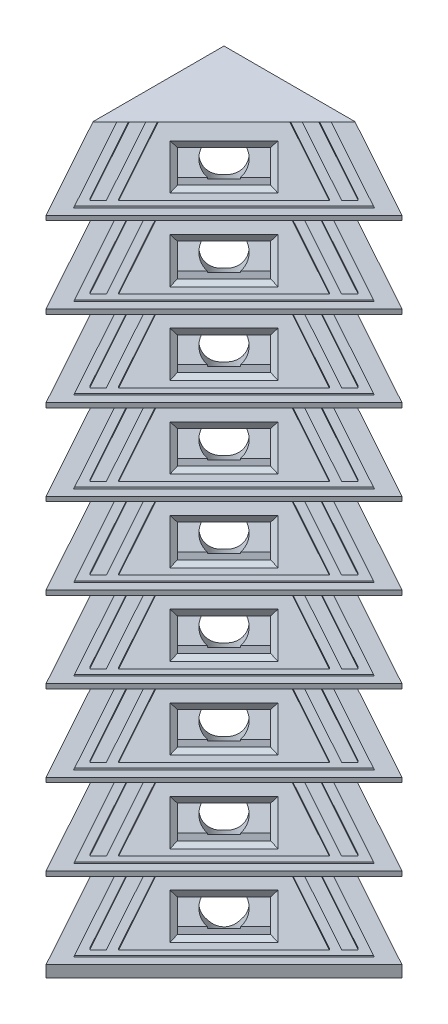
from build123d import *

# Parameters (mm, degrees)
BOSS_EXTRUDE1_DEPTH        = 143
SKETCH6_W                  = 48.08326112
SKETCH6_H                  = 12.658146123
CUT_EXTRUDE2_DEPTH         = 9
CUT_EXTRUDE3_START         = -12.5
SKETCH6_6_W                = 12.6
SKETCH6_6_H                = 5.1
CUT_EXTRUDE3_DEPTH         = 146.771835388
CUT_EXTRUDE4_DEPTH         = 2.5
CUT_EXTRUDE6_START         = -10
SKETCH6_10_R               = 3.4
CUT_EXTRUDE6_DEPTH         = 20
CHAMFER2_SIZE              = 1
CHAMFER1_SIZE              = 10
CHAMFER1_SIZE2             = 5.773502692
LPATTERN4_COUNT            = 9
LPATTERN4_PITCH            = 15.5
LPATTERN4_COPY_1_DEPTH     = 2.5
LPATTERN4_COPY_2_DEPTH     = 2.5
LPATTERN4_COPY_3_DEPTH     = 2.5
LPATTERN4_COPY_4_DEPTH     = 2.5
LPATTERN4_COPY_5_DEPTH     = 2.5
LPATTERN4_COPY_6_DEPTH     = 2.5
LPATTERN4_COPY_7_DEPTH     = 2.5
LPATTERN4_COPY_8_DEPTH     = 2.5
CHAMFER2_OF_LPATTERN4_SIZE = 1


with BuildPart() as part:
    # Sketch1 → Boss-Extrude1 (new body)
    with BuildSketch(Plane(origin=(0, 0, 0), x_dir=(1, 0, 0), z_dir=(0, 1, 0))):
        Polygon((0, 0), (0, -34), (34, 0), align=None)
    extrude(amount=BOSS_EXTRUDE1_DEPTH)

    # Sketch6 → Cut-Extrude2 (cut)
    with BuildSketch(Plane(origin=(15.196708808, 12.408060783, 15.196708808), x_dir=(0.7071067811865475, 0, -0.7071067811865476), z_dir=(0.6123724356957942, 0.5000000000000011, 0.6123724356957941))):
        with Locations((0, 1.228595341)):
            Rectangle(SKETCH6_W, SKETCH6_H)
    cut_extrude2 = extrude(amount=CUT_EXTRUDE2_DEPTH, mode=Mode.SUBTRACT)

    # Sketch6<6> → Cut-Extrude3 (cut)
    with BuildSketch(Plane(origin=(15.196708808, 12.408060783, 15.196708808), x_dir=(0.7071067811865475, 0, -0.7071067811865476), z_dir=(0.6123724356957942, 0.5000000000000011, 0.6123724356957941)).offset(CUT_EXTRUDE3_START)):
        with Locations((0, 1.449522279)):
            Rectangle(SKETCH6_6_W, SKETCH6_6_H)
    cut_extrude3 = extrude(amount=CUT_EXTRUDE3_DEPTH, mode=Mode.SUBTRACT)

    # Sketch6<8> → Cut-Extrude4 (cut)
    with BuildSketch(Plane(origin=(15.196708808, 12.408060783, 15.196708808), x_dir=(0.7071067811865475, 0, -0.7071067811865476), z_dir=(0.6123724356957942, 0.5000000000000011, 0.6123724356957941))):
        Polygon((-12.806853251, 7.557668402), (-14.483904234, 7.557668402), (-20.312977295, -4.100477721), (0, -4.100477721), (0, -3.100477721), (-14.222807352, -3.100477721), (-8.89373429, 7.557668402), (-10.570785273, 7.557668402), (-15.899858335, -3.100477721), (-18.135926312, -3.100477721), align=None)
    cut_extrude4 = extrude(amount=-CUT_EXTRUDE4_DEPTH, mode=Mode.SUBTRACT)

    # Mirror1: Cut-Extrude4 across plane
    add(cut_extrude4.mirror(Plane(origin=(0, 0, 0), x_dir=(0.7071067811865478, 0, 0.7071067811865472), z_dir=(-0.7071067811865475, 0, 0.7071067811865477))), mode=Mode.SUBTRACT)

    # Sketch6<10> → Cut-Extrude6 (cut)
    with BuildSketch(Plane(origin=(15.196708808, 12.408060783, 15.196708808), x_dir=(0.7071067811865475, 0, -0.7071067811865476), z_dir=(0.6123724356957942, 0.5000000000000011, 0.6123724356957941)).offset(CUT_EXTRUDE6_START)):
        with Locations(Location((0, 1.449522279, 0), (0, 0, 48.590377891))):
            Circle(SKETCH6_10_R)
    cut_extrude6 = extrude(amount=-CUT_EXTRUDE6_DEPTH, mode=Mode.SUBTRACT)

    # Chamfer2
    chamfer2_edges = [part.edges().sort_by_distance(p)[0] for p in [
        (19.138998013, 13.6633839, 10.22945257),
        (15.585786438, 11.45501912, 15.585786438),
        (10.22945257, 13.6633839, 19.138998013),
        (13.782664146, 15.871748679, 13.782664146),
    ]]
    chamfer(chamfer2_edges, length=CHAMFER2_SIZE)

    # Chamfer1
    chamfer1_edges = [part.edges().sort_by_distance(p)[0] for p in [
        (17, 0, 17),
    ]]
    chamfer1_side = [part.faces().sort_by_distance(p)[0] for p in [
        (11.506855515, 0, 11.506855515),
    ]]
    chamfer(chamfer1_edges, length=CHAMFER1_SIZE, length2=CHAMFER1_SIZE2, reference=chamfer1_side[0])

    # LPattern4: Cut-Extrude2, Cut-Extrude3, Cut-Extrude4, Cut-Extrude6 ×9
    with Locations(*[(0, i * LPATTERN4_PITCH, 0) for i in range(1, LPATTERN4_COUNT)]):
        add(cut_extrude2, mode=Mode.SUBTRACT)
        add(cut_extrude3, mode=Mode.SUBTRACT)
        add(cut_extrude4, mode=Mode.SUBTRACT)
        add(cut_extrude6, mode=Mode.SUBTRACT)

    # LPattern4 copy 1 sketch → LPattern4 copy 1 (cut)
    with BuildSketch(Plane(origin=(15.196708808, 27.908060783, 15.196708808), x_dir=(-0.7071067811865476, 0, 0.7071067811865479), z_dir=(0.6123724356957944, 0.5000000000000011, 0.6123724356957941))):
        Polygon((-12.806853251, -7.557668402), (-14.483904234, -7.557668402), (-20.312977295, 4.100477721), (0, 4.100477721), (0, 3.100477721), (-14.222807352, 3.100477721), (-8.89373429, -7.557668402), (-10.570785273, -7.557668402), (-15.899858335, 3.100477721), (-18.135926312, 3.100477721), align=None)
    extrude(amount=-LPATTERN4_COPY_1_DEPTH, mode=Mode.SUBTRACT)

    # LPattern4 copy 2 sketch → LPattern4 copy 2 (cut)
    with BuildSketch(Plane(origin=(15.196708808, 43.408060783, 15.196708808), x_dir=(-0.7071067811865476, 0, 0.7071067811865479), z_dir=(0.6123724356957944, 0.5000000000000011, 0.6123724356957941))):
        Polygon((-12.806853251, -7.557668402), (-14.483904234, -7.557668402), (-20.312977295, 4.100477721), (0, 4.100477721), (0, 3.100477721), (-14.222807352, 3.100477721), (-8.89373429, -7.557668402), (-10.570785273, -7.557668402), (-15.899858335, 3.100477721), (-18.135926312, 3.100477721), align=None)
    extrude(amount=-LPATTERN4_COPY_2_DEPTH, mode=Mode.SUBTRACT)

    # LPattern4 copy 3 sketch → LPattern4 copy 3 (cut)
    with BuildSketch(Plane(origin=(15.196708808, 58.908060783, 15.196708808), x_dir=(-0.7071067811865476, 0, 0.7071067811865479), z_dir=(0.6123724356957944, 0.5000000000000011, 0.6123724356957941))):
        Polygon((-12.806853251, -7.557668402), (-14.483904234, -7.557668402), (-20.312977295, 4.100477721), (0, 4.100477721), (0, 3.100477721), (-14.222807352, 3.100477721), (-8.89373429, -7.557668402), (-10.570785273, -7.557668402), (-15.899858335, 3.100477721), (-18.135926312, 3.100477721), align=None)
    extrude(amount=-LPATTERN4_COPY_3_DEPTH, mode=Mode.SUBTRACT)

    # LPattern4 copy 4 sketch → LPattern4 copy 4 (cut)
    with BuildSketch(Plane(origin=(15.196708808, 74.408060783, 15.196708808), x_dir=(-0.7071067811865476, 0, 0.7071067811865479), z_dir=(0.6123724356957944, 0.5000000000000011, 0.6123724356957941))):
        Polygon((-12.806853251, -7.557668402), (-14.483904234, -7.557668402), (-20.312977295, 4.100477721), (0, 4.100477721), (0, 3.100477721), (-14.222807352, 3.100477721), (-8.89373429, -7.557668402), (-10.570785273, -7.557668402), (-15.899858335, 3.100477721), (-18.135926312, 3.100477721), align=None)
    extrude(amount=-LPATTERN4_COPY_4_DEPTH, mode=Mode.SUBTRACT)

    # LPattern4 copy 5 sketch → LPattern4 copy 5 (cut)
    with BuildSketch(Plane(origin=(15.196708808, 89.908060783, 15.196708808), x_dir=(-0.7071067811865476, 0, 0.7071067811865479), z_dir=(0.6123724356957944, 0.5000000000000011, 0.6123724356957941))):
        Polygon((-12.806853251, -7.557668402), (-14.483904234, -7.557668402), (-20.312977295, 4.100477721), (0, 4.100477721), (0, 3.100477721), (-14.222807352, 3.100477721), (-8.89373429, -7.557668402), (-10.570785273, -7.557668402), (-15.899858335, 3.100477721), (-18.135926312, 3.100477721), align=None)
    extrude(amount=-LPATTERN4_COPY_5_DEPTH, mode=Mode.SUBTRACT)

    # LPattern4 copy 6 sketch → LPattern4 copy 6 (cut)
    with BuildSketch(Plane(origin=(15.196708808, 105.408060783, 15.196708808), x_dir=(-0.7071067811865476, 0, 0.7071067811865479), z_dir=(0.6123724356957944, 0.5000000000000011, 0.6123724356957941))):
        Polygon((-12.806853251, -7.557668402), (-14.483904234, -7.557668402), (-20.312977295, 4.100477721), (0, 4.100477721), (0, 3.100477721), (-14.222807352, 3.100477721), (-8.89373429, -7.557668402), (-10.570785273, -7.557668402), (-15.899858335, 3.100477721), (-18.135926312, 3.100477721), align=None)
    extrude(amount=-LPATTERN4_COPY_6_DEPTH, mode=Mode.SUBTRACT)

    # LPattern4 copy 7 sketch → LPattern4 copy 7 (cut)
    with BuildSketch(Plane(origin=(15.196708808, 120.908060783, 15.196708808), x_dir=(-0.7071067811865476, 0, 0.7071067811865479), z_dir=(0.6123724356957944, 0.5000000000000011, 0.6123724356957941))):
        Polygon((-12.806853251, -7.557668402), (-14.483904234, -7.557668402), (-20.312977295, 4.100477721), (0, 4.100477721), (0, 3.100477721), (-14.222807352, 3.100477721), (-8.89373429, -7.557668402), (-10.570785273, -7.557668402), (-15.899858335, 3.100477721), (-18.135926312, 3.100477721), align=None)
    extrude(amount=-LPATTERN4_COPY_7_DEPTH, mode=Mode.SUBTRACT)

    # LPattern4 copy 8 sketch → LPattern4 copy 8 (cut)
    with BuildSketch(Plane(origin=(15.196708808, 136.408060783, 15.196708808), x_dir=(-0.7071067811865476, 0, 0.7071067811865479), z_dir=(0.6123724356957944, 0.5000000000000011, 0.6123724356957941))):
        Polygon((-12.806853251, -7.557668402), (-14.483904234, -7.557668402), (-20.312977295, 4.100477721), (0, 4.100477721), (0, 3.100477721), (-14.222807352, 3.100477721), (-8.89373429, -7.557668402), (-10.570785273, -7.557668402), (-15.899858335, 3.100477721), (-18.135926312, 3.100477721), align=None)
    extrude(amount=-LPATTERN4_COPY_8_DEPTH, mode=Mode.SUBTRACT)

    # Chamfer2 of LPattern4
    chamfer2_of_lpattern4_edges = [part.edges().sort_by_distance(p)[0] for p in [
        (19.138998013, 29.1633839, 10.22945257),
        (15.585786438, 26.95501912, 15.585786438),
        (10.22945257, 29.1633839, 19.138998013),
        (13.782664146, 31.371748679, 13.782664146),
        (19.138998013, 44.6633839, 10.22945257),
        (15.585786438, 42.45501912, 15.585786438),
        (10.22945257, 44.6633839, 19.138998013),
        (13.782664146, 46.871748679, 13.782664146),
        (19.138998013, 60.1633839, 10.22945257),
        (15.585786438, 57.95501912, 15.585786438),
        (10.22945257, 60.1633839, 19.138998013),
        (13.782664146, 62.371748679, 13.782664146),
        (19.138998013, 75.6633839, 10.22945257),
        (15.585786438, 73.45501912, 15.585786438),
        (10.22945257, 75.6633839, 19.138998013),
        (13.782664146, 77.871748679, 13.782664146),
        (19.138998013, 91.1633839, 10.22945257),
        (15.585786438, 88.95501912, 15.585786438),
        (10.22945257, 91.1633839, 19.138998013),
        (13.782664146, 93.371748679, 13.782664146),
        (19.138998013, 106.6633839, 10.22945257),
        (15.585786438, 104.45501912, 15.585786438),
        (10.22945257, 106.6633839, 19.138998013),
        (13.782664146, 108.871748679, 13.782664146),
        (19.138998013, 122.1633839, 10.22945257),
        (15.585786438, 119.95501912, 15.585786438),
        (10.22945257, 122.1633839, 19.138998013),
        (13.782664146, 124.371748679, 13.782664146),
        (19.138998013, 137.6633839, 10.22945257),
        (15.585786438, 135.45501912, 15.585786438),
        (10.22945257, 137.6633839, 19.138998013),
        (13.782664146, 139.871748679, 13.782664146),
    ]]
    chamfer(chamfer2_of_lpattern4_edges, length=CHAMFER2_OF_LPATTERN4_SIZE)


solid = part.part
